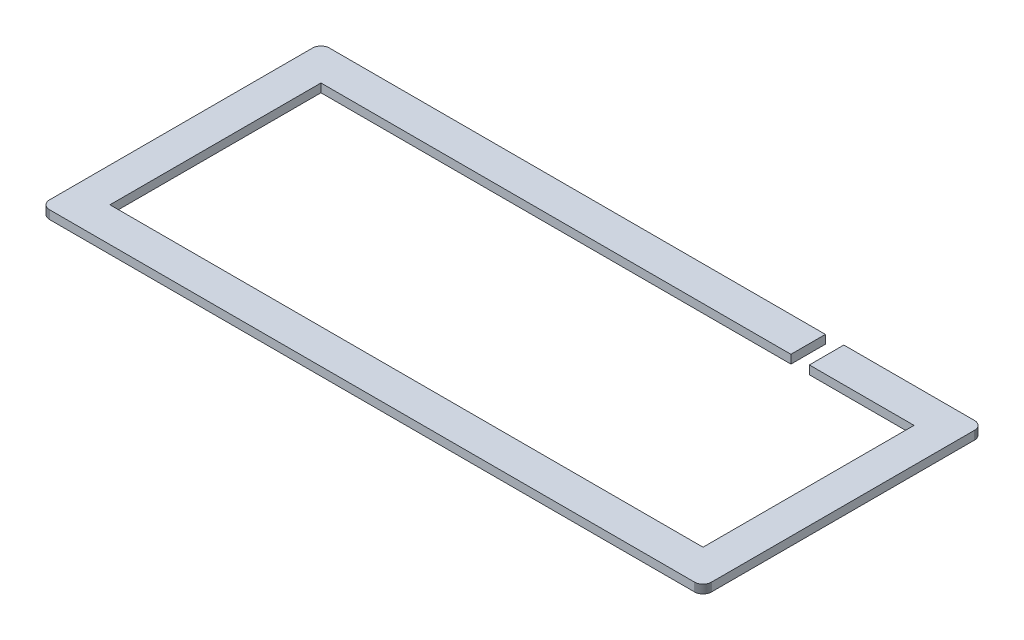
from build123d import *

# Parameters (mm, degrees)
BOSS_EXTRUDE1_DEPTH = 5


with BuildPart() as part:
    # Sketch1 → Boss-Extrude1 (new body)
    with BuildSketch(Plane(origin=(0, 0, 0), x_dir=(1, 0, 0), z_dir=(0, 1, 0))):
        Polygon((295.626, 164.299), (295.626, 144.099), (20.2944, 144.099), (20.2944, 20.4735), (367.757, 20.4735), (367.757, 144.099), (306.426, 144.099), (306.426, 164.299), (382.958, 164.299), (383.35, 164.284), (383.741, 164.237), (384.126, 164.162), (384.503, 164.055), (384.87, 163.919), (385.226, 163.755), (385.572, 163.564), (385.897, 163.344), (386.203, 163.102), (386.493, 162.834), (386.761, 162.547), (387.004, 162.238), (387.223, 161.913), (387.414, 161.569), (387.576, 161.212), (387.713, 160.845), (387.819, 160.467), (387.897, 160.082), (387.943, 159.693), (387.96, 159.299), (387.96, 5.27237), (387.943, 4.881), (387.897, 4.49104), (387.819, 4.10655), (387.713, 3.72759), (387.576, 3.35966), (387.414, 3.00412), (387.223, 2.66099), (387.004, 2.3344), (386.761, 2.02572), (386.493, 1.73771), (386.203, 1.47037), (385.897, 1.22783), (385.572, 1.0101), (385.226, 0.818554), (384.87, 0.654569), (384.503, 0.518142), (384.126, 0.412034), (383.741, 0.334863), (383.35, 0.289388), (382.958, 0.272852), (5.09598, 0.272852), (4.70186, 0.289388), (4.3119, 0.334863), (3.9274, 0.412034), (3.54983, 0.518142), (3.18189, 0.654569), (2.82498, 0.818554), (2.48185, 1.0101), (2.15663, 1.22783), (1.84795, 1.47037), (1.55994, 1.73771), (1.2926, 2.02572), (1.05006, 2.3344), (0.830957, 2.66099), (0.63941, 3.00412), (0.475424, 3.35966), (0.338998, 3.72759), (0.232888, 4.10655), (0.157097, 4.49104), (0.110243, 4.881), (0.0950846, 5.27375), (0.0950846, 159.299), (0.110243, 159.693), (0.157097, 160.082), (0.232888, 160.467), (0.338998, 160.845), (0.475424, 161.212), (0.63941, 161.569), (0.830957, 161.913), (1.05006, 162.238), (1.2926, 162.547), (1.55994, 162.834), (1.84795, 163.102), (2.15663, 163.344), (2.48185, 163.564), (2.82498, 163.755), (3.18189, 163.919), (3.54983, 164.055), (3.9274, 164.162), (4.3119, 164.237), (4.70186, 164.284), (5.09598, 164.299), align=None)
    extrude(amount=BOSS_EXTRUDE1_DEPTH)


solid = part.part
